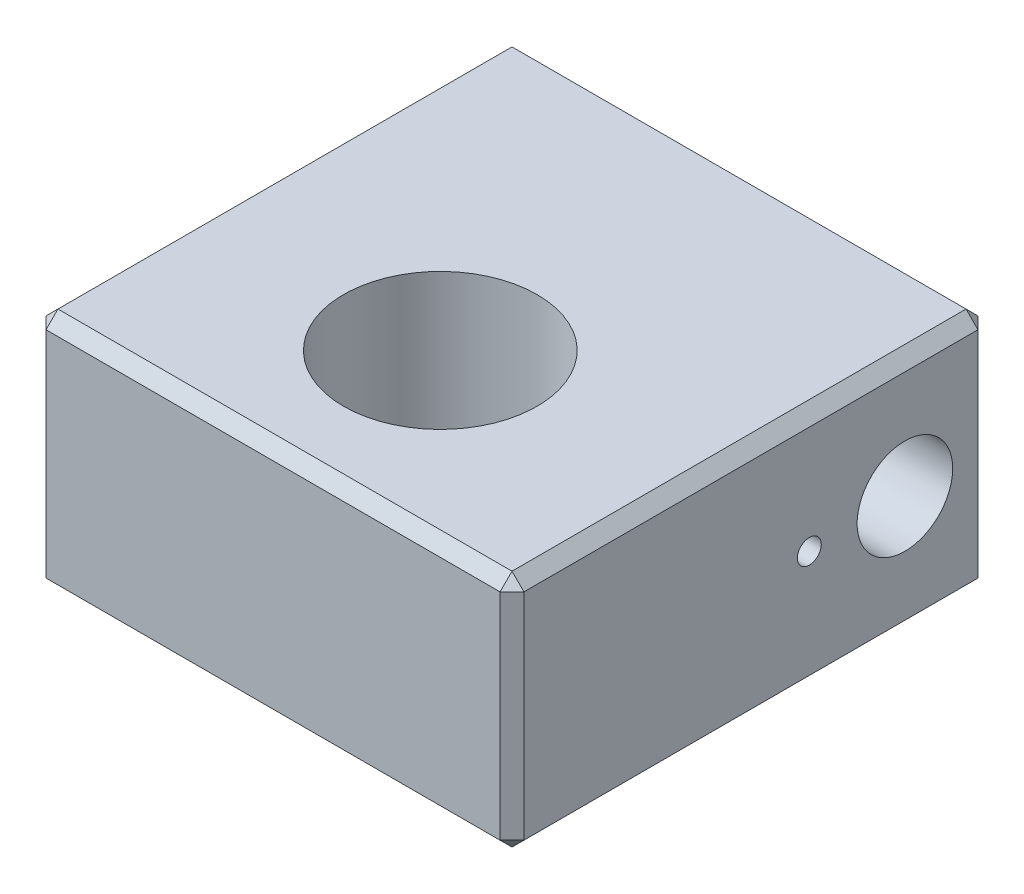
from build123d import *

# Parameters (mm, degrees)
SKETCH1_W           = 20
SKETCH1_H           = 20
BOSS_EXTRUDE1_DEPTH = 5
SKETCH2_R           = 4.05
CUT_EXTRUDE1_DEPTH  = 18.320508076
SKETCH3_R           = 2
CUT_EXTRUDE2_DEPTH  = 23.912878475
SKETCH4_R           = 0.5
CUT_EXTRUDE3_DEPTH  = 10
CHAMFER1_SIZE       = 0.5


with BuildPart() as part:
    # Sketch1 → Boss-Extrude1 (new, symmetric)
    with BuildSketch(Plane(origin=(0, 0, 0), x_dir=(1, 0, 0), z_dir=(0, 1, 0))):
        Rectangle(SKETCH1_W, SKETCH1_H)
    extrude(amount=BOSS_EXTRUDE1_DEPTH, both=True)

    # Sketch2 → Cut-Extrude1 (cut, through all)
    with BuildSketch(Plane(origin=(0, 5, 0), x_dir=(1, 0, 0), z_dir=(0, 1, 0))):
        with Locations(Location((0, -3, 0), (0, 0, 270))):
            Circle(SKETCH2_R)
    extrude(amount=-CUT_EXTRUDE1_DEPTH, mode=Mode.SUBTRACT)

    # Sketch3 → Cut-Extrude2 (cut, through all)
    with BuildSketch(Plane(origin=(10, 0, 0), x_dir=(0, 0, -1), z_dir=(1, 0, 0))):
        with Locations((6.442090049, 0)):
            Circle(SKETCH3_R)
    extrude(amount=-CUT_EXTRUDE2_DEPTH, mode=Mode.SUBTRACT)

    # Sketch4 → Cut-Extrude3 (cut)
    with BuildSketch(Plane(origin=(10, 0, 0), x_dir=(0, 0, -1), z_dir=(1, 0, 0))):
        with Locations((2.442090049, 0)):
            Circle(SKETCH4_R)
    extrude(amount=-CUT_EXTRUDE3_DEPTH, mode=Mode.SUBTRACT)

    # Chamfer1
    chamfer1_edges = [part.edges().sort_by_distance(p)[0] for p in [
        (-10, 5, 0),
        (0, 5, 10),
        (10, 5, 0),
        (0, -5, 10),
        (-10, -5, 0),
        (0, -5, -10),
        (10, -5, 0),
        (10, 0, 10),
        (-10, 0, 10),
        (-10, 0, -10),
        (10, 0, -10),
        (0, 5, -10),
    ]]
    chamfer(chamfer1_edges, length=CHAMFER1_SIZE)


solid = part.part
